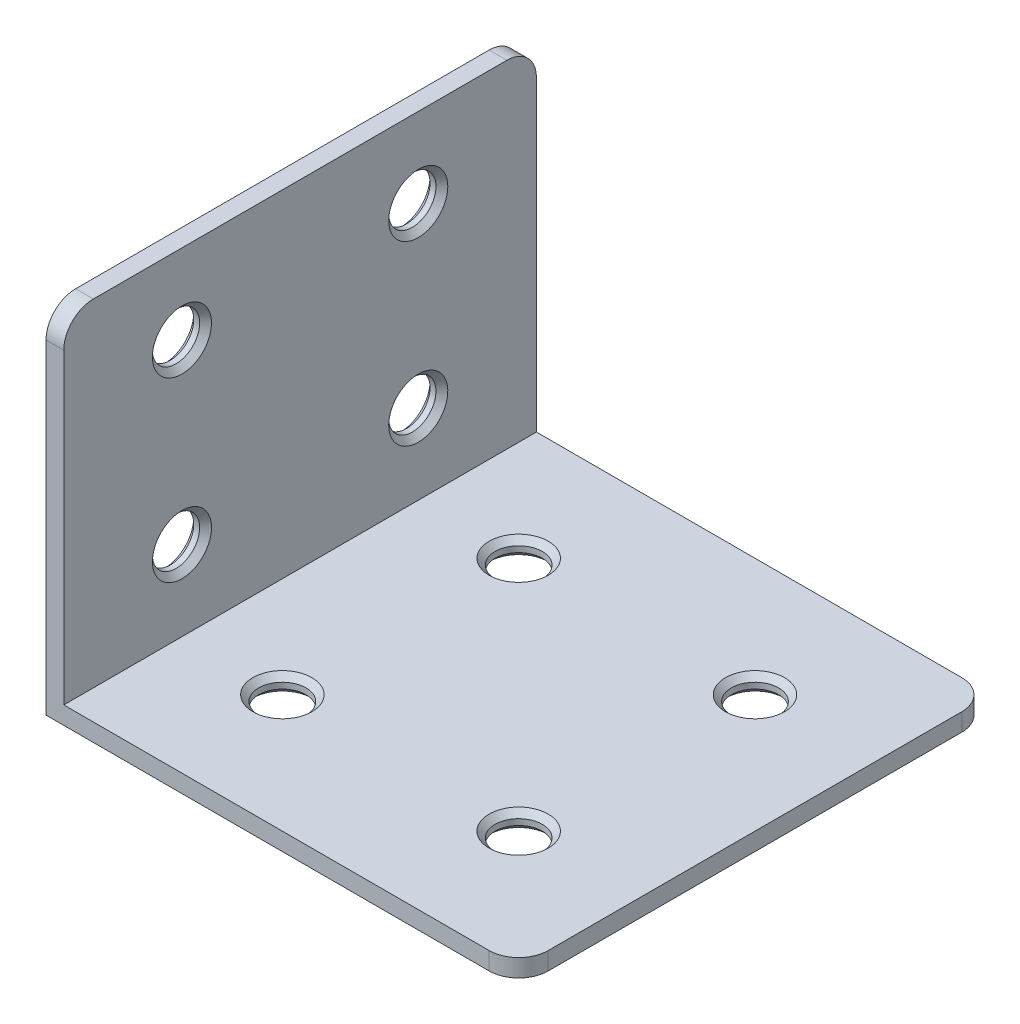
from build123d import *

# Parameters (mm, degrees)
SZKIC1_W                    = 80
SZKIC1_H                    = 80
DODANIE_WYCI_GNI_CIE1_DEPTH = 60
SZKIC2_W                    = 77
SZKIC2_H                    = 57
WYTNIJ_WYCI_GNI_CIE1_DEPTH  = 108.703296143
SZKIC4_R                    = 4
WYTNIJ_WYCI_GNI_CIE2_DEPTH  = 81.305666052
SZKIC3_R                    = 4
WYTNIJ_WYCI_GNI_CIE3_DEPTH  = 60
ZAOKR_GLENIE1_R             = 5
SFAZOWANIE1_SIZE            = 1


with BuildPart() as part:
    # Szkic1 → Dodanie-wyciągnięcie1 (new body)
    with BuildSketch(Plane(origin=(0, 0, 0), x_dir=(1, 0, 0), z_dir=(0, 1, 0))):
        Rectangle(SZKIC1_W, SZKIC1_H)
    extrude(amount=DODANIE_WYCI_GNI_CIE1_DEPTH)

    # Szkic2 → Wytnij-wyciągnięcie1 (cut, through all)
    with BuildSketch(Plane.XY.offset(40)):
        with Locations((1.5, 31.5)):
            Rectangle(SZKIC2_W, SZKIC2_H)
    extrude(amount=-WYTNIJ_WYCI_GNI_CIE1_DEPTH, mode=Mode.SUBTRACT)

    # Szkic4 → Wytnij-wyciągnięcie2 (cut, through all)
    with BuildSketch(Plane(origin=(0, 3, 0), x_dir=(1, 0, 0), z_dir=(0, 1, 0))):
        with Locations(Location((20, -20, 0), (0, 0, 180))):
            Circle(SZKIC4_R)
        with Locations(Location((20, 20, 0), (0, 0, 180))):
            Circle(SZKIC4_R)
        with Locations(Location((-20, 20, 0), (0, 0, 180))):
            Circle(SZKIC4_R)
        with Locations((-20, -20)):
            Circle(SZKIC4_R)
    extrude(amount=-WYTNIJ_WYCI_GNI_CIE2_DEPTH, mode=Mode.SUBTRACT)

    # Szkic3 → Wytnij-wyciągnięcie3 (cut)
    with BuildSketch(Plane(origin=(-37, 0, 0), x_dir=(0, 0, -1), z_dir=(1, 0, 0))):
        with Locations(Location((-20, 46.5, 0), (0, 0, 90))):
            Circle(SZKIC3_R)
        with Locations((-20, 16.5)):
            Circle(SZKIC3_R)
        with Locations(Location((20, 16.5, 0), (0, 0, 90))):
            Circle(SZKIC3_R)
        with Locations((20, 46.5)):
            Circle(SZKIC3_R)
    extrude(amount=-WYTNIJ_WYCI_GNI_CIE3_DEPTH, mode=Mode.SUBTRACT)

    # Zaokrąglenie1
    zaokr_glenie1_edges = [part.edges().sort_by_distance(p)[0] for p in [
        (-38.5, 60, -40),
        (40, 1.5, 40),
        (40, 1.5, -40),
        (-38.5, 60, 40),
    ]]
    fillet(zaokr_glenie1_edges, radius=ZAOKR_GLENIE1_R)

    # Sfazowanie1
    sfazowanie1_edges = [part.edges().sort_by_distance(p)[0] for p in [
        (-24, 3, 20),
        (-24, 0, 20),
        (-16, 0, -20),
        (-16, 3, -20),
        (24, 3, -20),
        (24, 0, -20),
        (24, 0, 20),
        (24, 3, 20),
        (-40, 46.5, -16),
        (-37, 46.5, -16),
        (-40, 12.5, -20),
        (-37, 12.5, -20),
        (-40, 16.5, 24),
        (-37, 16.5, 24),
        (-40, 42.5, 20),
        (-37, 42.5, 20),
    ]]
    chamfer(sfazowanie1_edges, length=SFAZOWANIE1_SIZE)


solid = part.part
